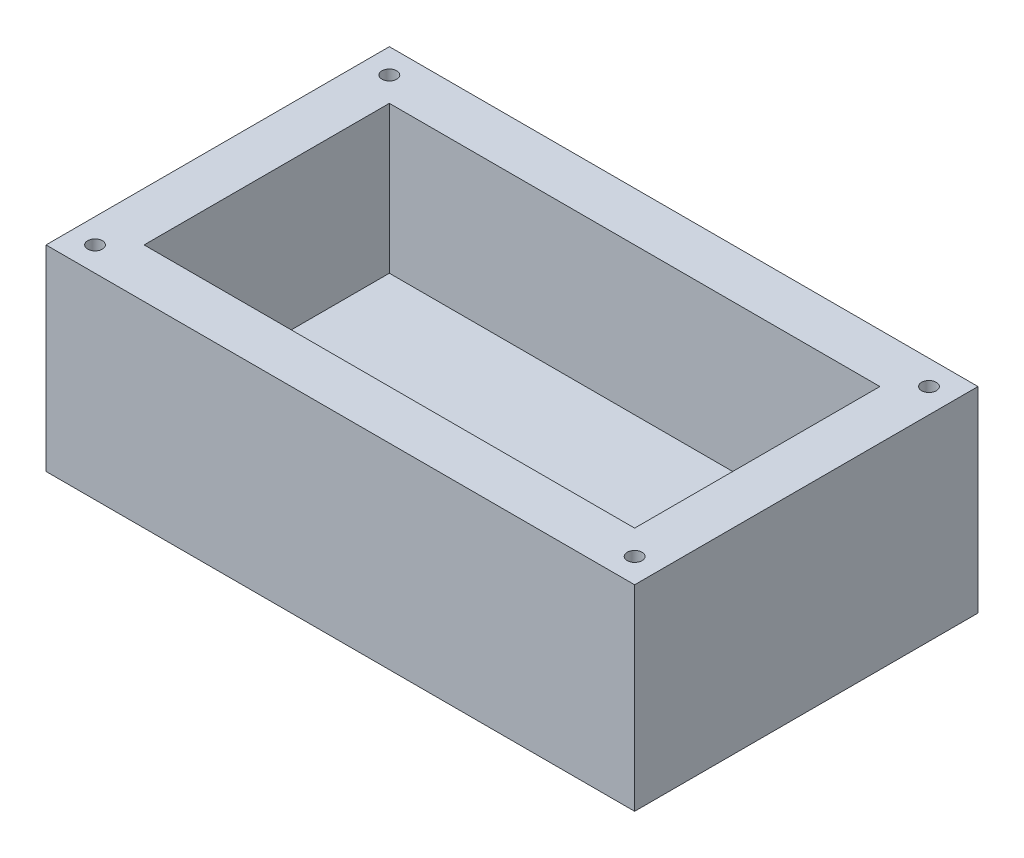
from build123d import *

# Parameters (mm, degrees)
CROQUIS1_W              = 120
CROQUIS1_H              = 70
SALIENTE_EXTRUIR1_DEPTH = 40
CROQUIS2_W              = 100
CROQUIS2_H              = 50
CORTAR_EXTRUIR1_DEPTH   = 30
CROQUIS3_R              = 1.5
CORTAR_EXTRUIR2_DEPTH   = 10


with BuildPart() as part:
    # Croquis1 → Saliente-Extruir1 (new body)
    with BuildSketch(Plane(origin=(0, 0, 0), x_dir=(1, 0, 0), z_dir=(0, 1, 0))):
        Rectangle(CROQUIS1_W, CROQUIS1_H)
    extrude(amount=SALIENTE_EXTRUIR1_DEPTH)

    # Croquis2 → Cortar-Extruir1 (cut)
    with BuildSketch(Plane(origin=(0, 40, 0), x_dir=(1, 0, 0), z_dir=(0, 1, 0))):
        Rectangle(CROQUIS2_W, CROQUIS2_H)
    extrude(amount=-CORTAR_EXTRUIR1_DEPTH, mode=Mode.SUBTRACT)

    # Croquis3 → Cortar-Extruir2 (cut)
    with BuildSketch(Plane(origin=(0, 40, 0), x_dir=(1, 0, 0), z_dir=(0, 1, 0))):
        with Locations(Location((-55, -30, 0), (0, 0, 270))):
            Circle(CROQUIS3_R)
        with Locations(Location((-55, 30, 0), (0, 0, 270))):
            Circle(CROQUIS3_R)
        with Locations(Location((55, 30, 0), (0, 0, 270))):
            Circle(CROQUIS3_R)
        with Locations(Location((55, -30, 0), (0, 0, 270))):
            Circle(CROQUIS3_R)
    extrude(amount=-CORTAR_EXTRUIR2_DEPTH, mode=Mode.SUBTRACT)


solid = part.part
